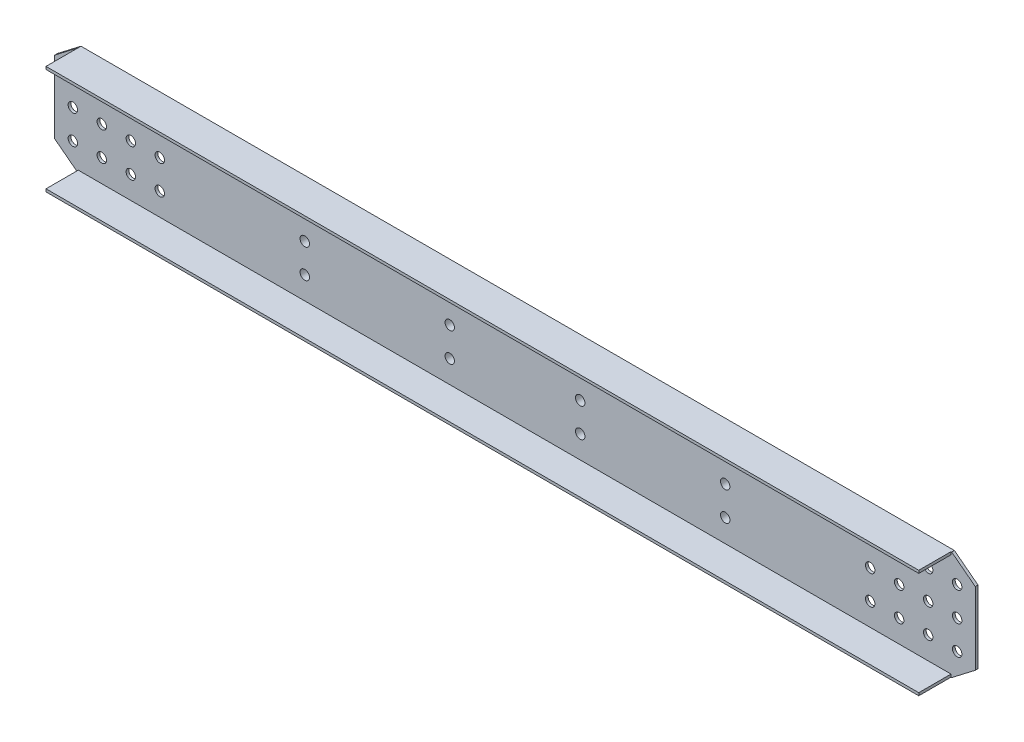
from build123d import *

# Parameters (mm, degrees)
SKETCH_1_R          = 13
EXTRUDE_727_DEPTH   = 7.5
SKETCH_2_W          = 2408.049034164
SKETCH_2_H          = 7.5
EXTRUDE_1_DEPTH     = 89
SKETCH_3_W          = 80
SKETCH_3_H          = 240
EXTRUDE_2_DEPTH     = 16
SKETCH_4_R          = 13
CUT_EXTRUDE_1_DEPTH = 1308.983562588


with BuildPart() as part:
    # 草图1 → Extrude 727 (new body)
    with BuildSketch(Plane.XY):
        Polygon((-1205, 0), (1205, 0), (1270, 50), (1270, 250), (1205, 300), (-1205, 300), (-1270, 250), (-1270, 50), align=None)
        with Locations((-1220, 230)):
            Circle(SKETCH_1_R, mode=Mode.SUBTRACT)
        with Locations((-1220, 150)):
            Circle(SKETCH_1_R, mode=Mode.SUBTRACT)
        with Locations((-1140, 230)):
            Circle(SKETCH_1_R, mode=Mode.SUBTRACT)
        with Locations((-1140, 150)):
            Circle(SKETCH_1_R, mode=Mode.SUBTRACT)
        with Locations((-1060, 230)):
            Circle(SKETCH_1_R, mode=Mode.SUBTRACT)
        with Locations((-1060, 150)):
            Circle(SKETCH_1_R, mode=Mode.SUBTRACT)
        with Locations((-980, 150)):
            Circle(SKETCH_1_R, mode=Mode.SUBTRACT)
        with Locations(Location((-1060, 70, 0), (0, 0, 180))):
            Circle(SKETCH_1_R, mode=Mode.SUBTRACT)
        with Locations(Location((-1140, 70, 0), (0, 0, 180))):
            Circle(SKETCH_1_R, mode=Mode.SUBTRACT)
        with Locations(Location((-1220, 70, 0), (0, 0, 180))):
            Circle(SKETCH_1_R, mode=Mode.SUBTRACT)
        with Locations((1220, 70)):
            Circle(SKETCH_1_R, mode=Mode.SUBTRACT)
        with Locations((1140, 70)):
            Circle(SKETCH_1_R, mode=Mode.SUBTRACT)
        with Locations((1060, 70)):
            Circle(SKETCH_1_R, mode=Mode.SUBTRACT)
        with Locations(Location((980, 150, 0), (0, 0, 180))):
            Circle(SKETCH_1_R, mode=Mode.SUBTRACT)
        with Locations(Location((1060, 150, 0), (0, 0, 180))):
            Circle(SKETCH_1_R, mode=Mode.SUBTRACT)
        with Locations(Location((1060, 230, 0), (0, 0, 180))):
            Circle(SKETCH_1_R, mode=Mode.SUBTRACT)
        with Locations(Location((1140, 150, 0), (0, 0, 180))):
            Circle(SKETCH_1_R, mode=Mode.SUBTRACT)
        with Locations(Location((1140, 230, 0), (0, 0, 180))):
            Circle(SKETCH_1_R, mode=Mode.SUBTRACT)
        with Locations(Location((1220, 150, 0), (0, 0, 180))):
            Circle(SKETCH_1_R, mode=Mode.SUBTRACT)
        with Locations(Location((1220, 230, 0), (0, 0, 180))):
            Circle(SKETCH_1_R, mode=Mode.SUBTRACT)
        with Locations((-980, 70)):
            Circle(SKETCH_1_R, mode=Mode.SUBTRACT)
        with Locations((-980, 230)):
            Circle(SKETCH_1_R, mode=Mode.SUBTRACT)
        with Locations((980, 70)):
            Circle(SKETCH_1_R, mode=Mode.SUBTRACT)
        with Locations((980, 230)):
            Circle(SKETCH_1_R, mode=Mode.SUBTRACT)
    extrude(amount=-EXTRUDE_727_DEPTH)

    # 草图2 → 凸台-拉伸1 (add)
    with BuildSketch(Plane.XY):
        with Locations((-0.975482918, 296.25)):
            Rectangle(SKETCH_2_W, SKETCH_2_H)
        with Locations((-0.975482918, 3.75)):
            Rectangle(SKETCH_2_W, SKETCH_2_H)
    extrude(amount=EXTRUDE_1_DEPTH)

    # 草图3 → 凸台-拉伸2 (add)
    with BuildSketch(Plane(origin=(0, 0, -7.5), x_dir=(-1, 0, 0), z_dir=(0, 0, -1))):
        with Locations((-580, 150)):
            Rectangle(SKETCH_3_W, SKETCH_3_H)
        with Locations((-180, 150)):
            Rectangle(SKETCH_3_W, SKETCH_3_H)
        with Locations((180, 150)):
            Rectangle(SKETCH_3_W, SKETCH_3_H)
        with Locations((580, 150)):
            Rectangle(SKETCH_3_W, SKETCH_3_H)
    extrude(amount=EXTRUDE_2_DEPTH)

    # 草图4 → 切除-拉伸1 (cut, through all)
    with BuildSketch(Plane.XY):
        with Locations((-580, 230)):
            Circle(SKETCH_4_R)
        with Locations((-580, 150)):
            Circle(SKETCH_4_R)
        with Locations((-180, 230)):
            Circle(SKETCH_4_R)
        with Locations((-180, 150)):
            Circle(SKETCH_4_R)
        with Locations(Location((-180, 70, 0), (0, 0, 180))):
            Circle(SKETCH_4_R)
        with Locations(Location((-580, 70, 0), (0, 0, 180))):
            Circle(SKETCH_4_R)
        with Locations((580, 70)):
            Circle(SKETCH_4_R)
        with Locations((180, 70)):
            Circle(SKETCH_4_R)
        with Locations(Location((180, 150, 0), (0, 0, 180))):
            Circle(SKETCH_4_R)
        with Locations(Location((180, 230, 0), (0, 0, 180))):
            Circle(SKETCH_4_R)
        with Locations(Location((580, 150, 0), (0, 0, 180))):
            Circle(SKETCH_4_R)
        with Locations(Location((580, 230, 0), (0, 0, 180))):
            Circle(SKETCH_4_R)
    extrude(amount=-CUT_EXTRUDE_1_DEPTH, mode=Mode.SUBTRACT)


solid = part.part
